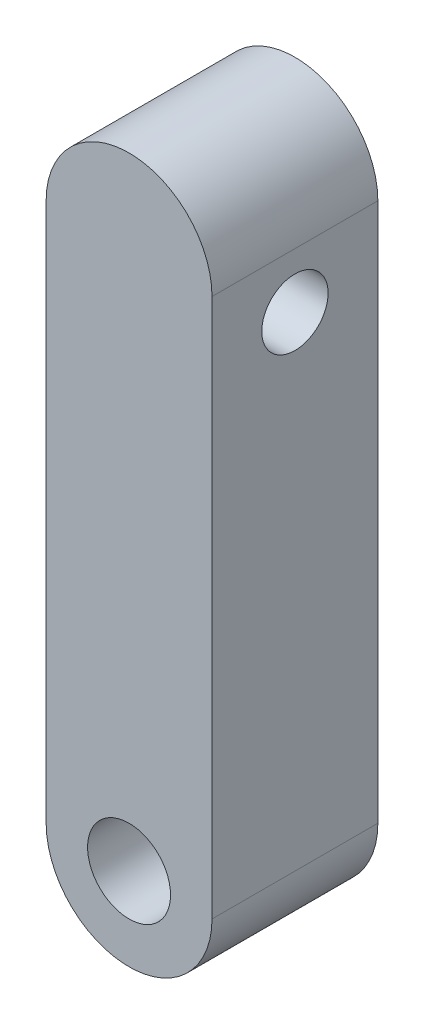
from build123d import *

# Parameters (mm, degrees)
SKETCH2_R           = 5
BOSS_EXTRUDE1_DEPTH = 20
SKETCH4_R           = 4
CUT_EXTRUDE1_DEPTH  = 55


with BuildPart() as part:
    # Sketch2 → Boss-Extrude1 (new body)
    with BuildSketch(Plane.XY):
        with BuildLine():
            Line((-10, 0), (-10, 65))
            ThreePointArc((-10, 65), (0, 75), (10, 65))
            Line((10, 65), (10, 0))
            ThreePointArc((10, 0), (0, -10), (-10, 0))
        make_face()
        Circle(SKETCH2_R, mode=Mode.SUBTRACT)
    extrude(amount=BOSS_EXTRUDE1_DEPTH)

    # Sketch4 → Cut-Extrude1 (cut)
    with BuildSketch(Plane(origin=(10, 0, 0), x_dir=(0, 0, -1), z_dir=(1, 0, 0))):
        with Locations((-10, 58.36)):
            Circle(SKETCH4_R)
    extrude(amount=-CUT_EXTRUDE1_DEPTH, mode=Mode.SUBTRACT)


solid = part.part
